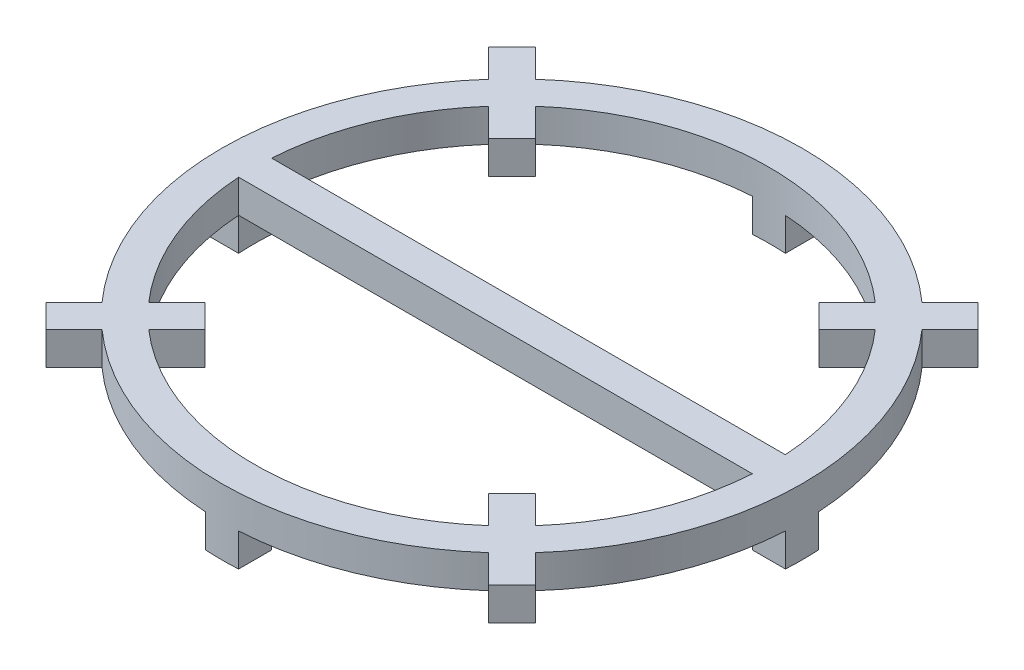
from build123d import *

# Parameters (mm, degrees)
BOSS_EXTRUDE1_DEPTH = 5
BOSS_EXTRUDE2_START = 5
BOSS_EXTRUDE2_DEPTH = 5


with BuildPart() as part:
    # Sketch1 → Boss-Extrude1 (new body)
    with BuildSketch(Plane(origin=(0, 0, 0), x_dir=(1, 0, 0), z_dir=(0, 1, 0))):
        with BuildLine():
            Line((-35.30507781, 35.30507781), (-37.072844763, 33.537310857))
            Line((-37.072844763, 33.537310857), (-32.830204076, 29.29467017))
            ThreePointArc((-32.830204076, 29.29467017), (-44, 0), (-32.830204076, -29.29467017))
            Line((-32.830204076, -29.29467017), (-37.072844763, -33.537310857))
            Line((-37.072844763, -33.537310857), (-35.30507781, -35.30507781))
            Line((-35.30507781, -35.30507781), (-33.537310857, -37.072844763))
            Line((-33.537310857, -37.072844763), (-29.29467017, -32.830204076))
            ThreePointArc((-29.29467017, -32.830204076), (0, -44), (29.29467017, -32.830204076))
            Line((29.29467017, -32.830204076), (33.537310857, -37.072844763))
            Line((33.537310857, -37.072844763), (35.30507781, -35.30507781))
            Line((35.30507781, -35.30507781), (37.072844763, -33.537310857))
            Line((37.072844763, -33.537310857), (32.830204076, -29.29467017))
            ThreePointArc((32.830204076, -29.29467017), (44, 0), (32.830204076, 29.29467017))
            Line((32.830204076, 29.29467017), (37.072844763, 33.537310857))
            Line((37.072844763, 33.537310857), (35.30507781, 35.30507781))
            Line((35.30507781, 35.30507781), (33.537310857, 37.072844763))
            Line((33.537310857, 37.072844763), (29.29467017, 32.830204076))
            ThreePointArc((29.29467017, 32.830204076), (0, 44), (-29.29467017, 32.830204076))
            Line((-29.29467017, 32.830204076), (-33.537310857, 37.072844763))
            Line((-33.537310857, 37.072844763), (-35.30507781, 35.30507781))
        make_face()
        with BuildLine():
            Line((-38.919789311, 2.5), (38.919789311, 2.5))
            ThreePointArc((38.919789311, 2.5), (36.031301768, 14.924653862), (29.288213897, 25.752679991))
            Line((29.288213897, 25.752679991), (25.04557321, 21.510039304))
            Line((25.04557321, 21.510039304), (21.510039304, 25.04557321))
            Line((21.510039304, 25.04557321), (25.752679991, 29.288213897))
            ThreePointArc((25.752679991, 29.288213897), (0, 39), (-25.752679991, 29.288213897))
            Line((-25.752679991, 29.288213897), (-21.510039304, 25.04557321))
            Line((-21.510039304, 25.04557321), (-25.04557321, 21.510039304))
            Line((-25.04557321, 21.510039304), (-29.288213897, 25.752679991))
            ThreePointArc((-29.288213897, 25.752679991), (-36.031301768, 14.924653862), (-38.919789311, 2.5))
        make_face(mode=Mode.SUBTRACT)
        with BuildLine():
            Line((38.919789311, -2.5), (-38.919789311, -2.5))
            ThreePointArc((-38.919789311, -2.5), (-36.031301768, -14.924653862), (-29.288213897, -25.752679991))
            Line((-29.288213897, -25.752679991), (-25.04557321, -21.510039304))
            Line((-25.04557321, -21.510039304), (-21.510039304, -25.04557321))
            Line((-21.510039304, -25.04557321), (-25.752679991, -29.288213897))
            ThreePointArc((-25.752679991, -29.288213897), (0, -39), (25.752679991, -29.288213897))
            Line((25.752679991, -29.288213897), (21.510039304, -25.04557321))
            Line((21.510039304, -25.04557321), (25.04557321, -21.510039304))
            Line((25.04557321, -21.510039304), (29.288213897, -25.752679991))
            ThreePointArc((29.288213897, -25.752679991), (36.031301768, -14.924653862), (38.919789311, -2.5))
        make_face(mode=Mode.SUBTRACT)
    extrude(amount=BOSS_EXTRUDE1_DEPTH)

    # Sketch2 → Boss-Extrude2 (add)
    with BuildSketch(Plane.XZ.offset(BOSS_EXTRUDE2_START)):
        with BuildLine():
            Line((-38.919789311, 2.5), (-43.928919859, 2.5))
            ThreePointArc((-43.928919859, 2.5), (-44, 0), (-43.928919859, -2.5))
            Line((-43.928919859, -2.5), (-38.919789311, -2.5))
            ThreePointArc((-38.919789311, -2.5), (-39, 0), (-38.919789311, 2.5))
        make_face()
        with BuildLine():
            Line((-2.5, 38.919789311), (-2.5, 43.928919859))
            ThreePointArc((-2.5, 43.928919859), (0, 44), (2.5, 43.928919859))
            Line((2.5, 43.928919859), (2.5, 38.919789311))
            ThreePointArc((2.5, 38.919789311), (0, 39), (-2.5, 38.919789311))
        make_face()
        with BuildLine():
            Line((38.919789311, -2.5), (43.928919859, -2.5))
            ThreePointArc((43.928919859, -2.5), (44, 0), (43.928919859, 2.5))
            Line((43.928919859, 2.5), (38.919789311, 2.5))
            ThreePointArc((38.919789311, 2.5), (39, 0), (38.919789311, -2.5))
        make_face()
        with BuildLine():
            Line((2.5, -43.928919859), (2.5, -38.919789311))
            ThreePointArc((2.5, -38.919789311), (0, -39), (-2.5, -38.919789311))
            Line((-2.5, -38.919789311), (-2.5, -43.928919859))
            ThreePointArc((-2.5, -43.928919859), (0, -44), (2.5, -43.928919859))
        make_face()
    extrude(amount=-BOSS_EXTRUDE2_DEPTH)


solid = part.part
